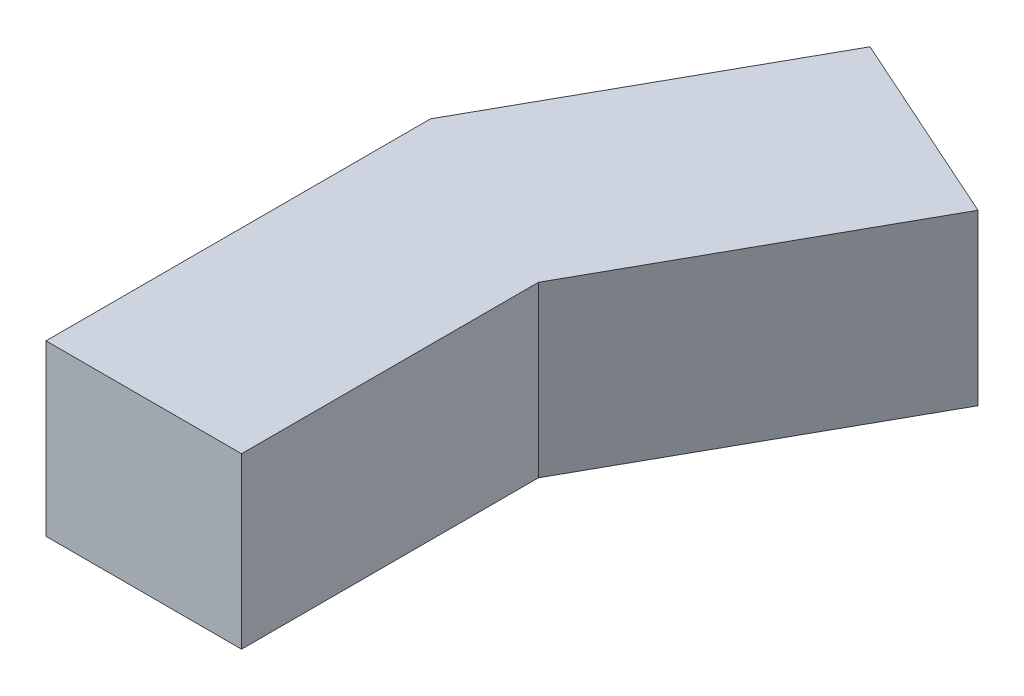
from build123d import *

# Parameters (mm, degrees)
BOSS_EXTRUDE1_DEPTH = 19.05


with BuildPart() as part:
    # Sketch1 → Boss-Extrude1 (new body)
    with BuildSketch(Plane(origin=(0, 0, 0), x_dir=(1, 0, 0), z_dir=(0, 1, 0))):
        Polygon((-11, 32.245966686), (0, 32.245966686), (11, 32.245966686), (11, 22.387267321), (28.706556195, 54.137267321), (6.706556195, 63.995966686), align=None)
        Polygon((11, 32.245966686), (0, 32.245966686), (0, 27.316617003), (11, 22.387267321), align=None)
        with BuildLine():
            Line((11, 22.387267321), (0, 27.316617003))
            Line((0, 27.316617003), (0, 24.413342341))
            ThreePointArc((0, 24.413342341), (3.049993619, 23.149993619), (4.313342341, 20.1))
            ThreePointArc((4.313342341, 20.1), (3.049993619, 17.050006381), (0, 15.786657659))
            Line((0, 15.786657659), (0, 4.27242655))
            ThreePointArc((0, 4.27242655), (3.021061785, 3.021061785), (4.27242655, 0))
            ThreePointArc((4.27242655, 0), (3.021061785, -3.021061785), (0, -4.27242655))
            Line((0, -4.27242655), (0, -11.017064321))
            Line((0, -11.017064321), (11, -11.017064321))
            Line((11, -11.017064321), (11, 22.387267321))
        make_face()
        Polygon((0, 27.316617003), (0, 32.245966686), (-11, 32.245966686), align=None)
        with BuildLine():
            Line((0, 24.413342341), (0, 27.316617003))
            Line((0, 27.316617003), (-11, 32.245966686))
            Line((-11, 32.245966686), (-11, -11.017064321))
            Line((-11, -11.017064321), (0, -11.017064321))
            Line((0, -11.017064321), (0, -4.27242655))
            ThreePointArc((0, -4.27242655), (-4.27242655, 0), (0, 4.27242655))
            Line((0, 4.27242655), (0, 15.786657659))
            ThreePointArc((0, 15.786657659), (-4.313342341, 20.1), (0, 24.413342341))
        make_face()
        with BuildLine():
            ThreePointArc((4.313342341, 20.1), (3.049993619, 23.149993619), (0, 24.413342341))
            Line((0, 24.413342341), (0, 15.786657659))
            ThreePointArc((0, 15.786657659), (3.049993619, 17.050006381), (4.313342341, 20.1))
        make_face()
        with BuildLine():
            Line((0, 15.786657659), (0, 24.413342341))
            ThreePointArc((0, 24.413342341), (-4.313342341, 20.1), (0, 15.786657659))
        make_face()
        with BuildLine():
            ThreePointArc((4.27242655, 0), (3.021061785, 3.021061785), (0, 4.27242655))
            Line((0, 4.27242655), (0, -4.27242655))
            ThreePointArc((0, -4.27242655), (3.021061785, -3.021061785), (4.27242655, 0))
        make_face()
        with BuildLine():
            Line((0, -4.27242655), (0, 4.27242655))
            ThreePointArc((0, 4.27242655), (-4.27242655, 0), (0, -4.27242655))
        make_face()
    extrude(amount=BOSS_EXTRUDE1_DEPTH)


solid = part.part
